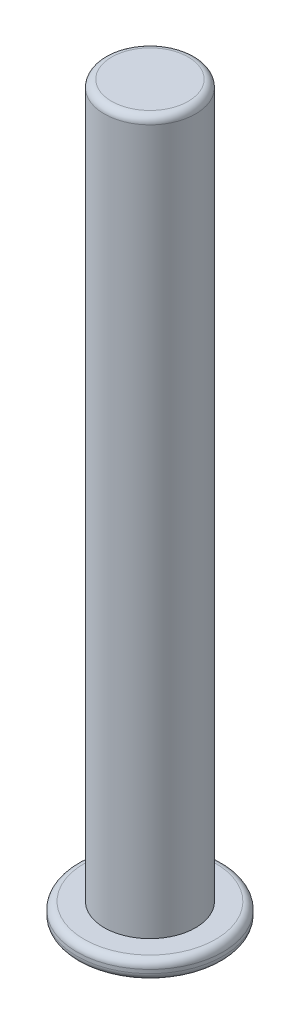
from build123d import *

# Parameters (mm, degrees)
SKETCH1_R           = 8
BOSS_EXTRUDE1_DEPTH = 2
SKETCH2_R           = 5
BOSS_EXTRUDE2_DEPTH = 80
FILLET3_R           = 0.8


with BuildPart() as part:
    # Sketch1 → Boss-Extrude1 (new body)
    with BuildSketch(Plane(origin=(0, 0, 0), x_dir=(1, 0, 0), z_dir=(0, 1, 0))):
        with Locations(Location((0, 0, 0), (0, 0, 270))):
            Circle(SKETCH1_R)
    extrude(amount=BOSS_EXTRUDE1_DEPTH)

    # Sketch2 → Boss-Extrude2 (add)
    with BuildSketch(Plane(origin=(0, 0, 0), x_dir=(1, 0, 0), z_dir=(0, 1, 0))):
        with Locations(Location((0, 0, 0), (0, 0, 270))):
            Circle(SKETCH2_R)
    extrude(amount=BOSS_EXTRUDE2_DEPTH)

    # Fillet3
    fillet3_edges = [part.edges().sort_by_distance(p)[0] for p in [
        (0, 0, -8),
        (0, 2, -8),
        (0, 80, -5),
    ]]
    fillet(fillet3_edges, radius=FILLET3_R)


solid = part.part
